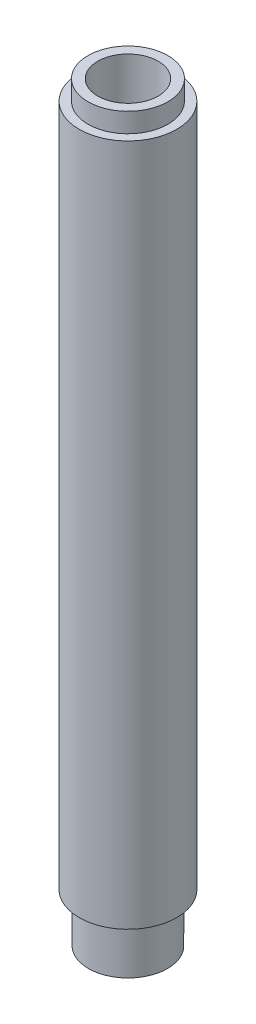
from build123d import *

# Parameters (mm, degrees)
SKETCH1_R           = 12.7
BOSS_EXTRUDE1_DEPTH = 177.8
SKETCH4_R           = 10.414
BOSS_EXTRUDE2_DEPTH = 5.08
SKETCH5_R           = 7.874
CUT_EXTRUDE1_DEPTH  = 184.759828036
SKETCH6_R           = 10.287
SKETCH6_R_2         = 7.874
BOSS_EXTRUDE3_DEPTH = 12.7


with BuildPart() as part:
    # Sketch1 → Boss-Extrude1 (new body)
    with BuildSketch(Plane(origin=(0, 0, 0), x_dir=(1, 0, 0), z_dir=(0, 1, 0))):
        with Locations(Location((0, 0, 0), (0, 0, 270))):
            Circle(SKETCH1_R)
    extrude(amount=BOSS_EXTRUDE1_DEPTH)

    # Sketch4 → Boss-Extrude2 (add)
    with BuildSketch(Plane(origin=(0, 177.8, 0), x_dir=(1, 0, 0), z_dir=(0, 1, 0))):
        with Locations(Location((0, 0, 0), (0, 0, 270))):
            Circle(SKETCH4_R)
    extrude(amount=BOSS_EXTRUDE2_DEPTH)

    # Sketch5 → Cut-Extrude1 (cut, through all)
    with BuildSketch(Plane(origin=(0, 182.88, 0), x_dir=(1, 0, 0), z_dir=(0, 1, 0))):
        with Locations(Location((0, 0, 0), (0, 0, 270))):
            Circle(SKETCH5_R)
    extrude(amount=-CUT_EXTRUDE1_DEPTH, mode=Mode.SUBTRACT)

    # Sketch6 → Boss-Extrude3 (add)
    with BuildSketch(Plane.XZ):
        with Locations(Location((0, 0, 0), (0, 0, 90))):
            Circle(SKETCH6_R)
        with Locations(Location((0, 0, 0), (0, 0, 90))):
            Circle(SKETCH6_R_2, mode=Mode.SUBTRACT)
    extrude(amount=BOSS_EXTRUDE3_DEPTH)


solid = part.part
